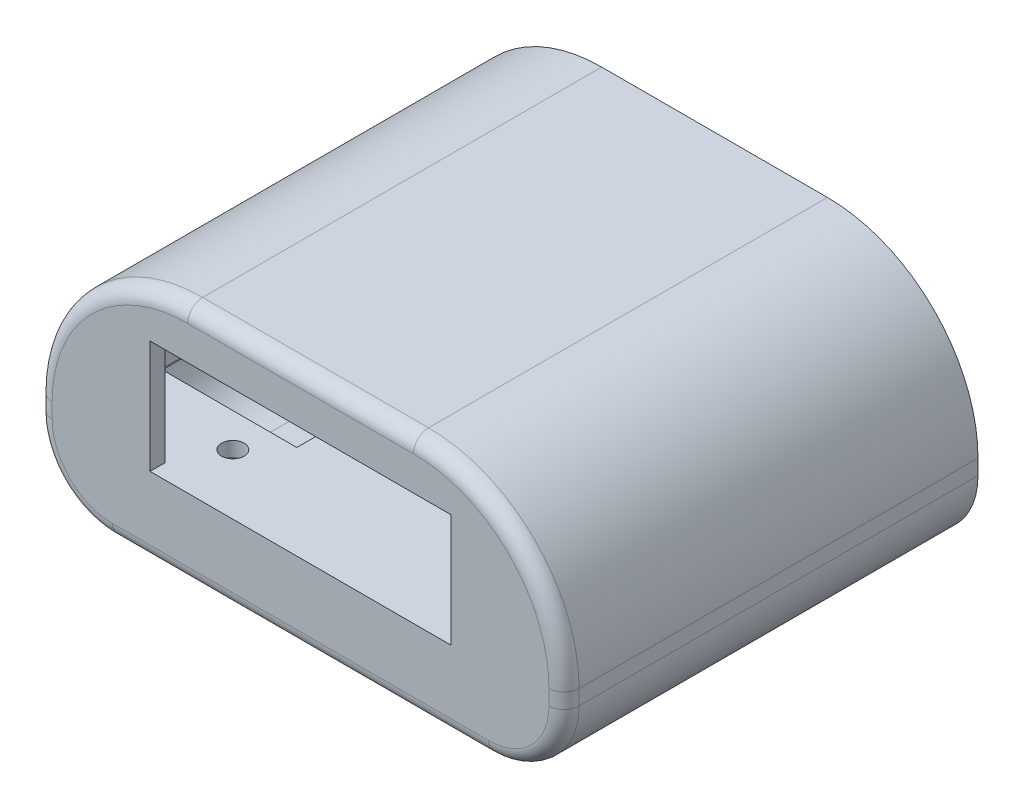
from build123d import *

# Parameters (mm, degrees)
BOSS_EXTRUDE1_DEPTH       = 55
SHELL1_T                  = -2
BOSS_EXTRUDE2_DEPTH       = 10
M3X0_5_TAPPED_HOLE1_D     = 2.5
M3X0_5_TAPPED_HOLE1_DEPTH = 7.5
M3X0_5_TAPPED_HOLE1_TIP   = 0.751075774
BOSS_EXTRUDE3_REACH       = 69.127
SKETCH5_W                 = 66
SKETCH5_H                 = 2
SKETCH6_W                 = 40
SKETCH6_H                 = 15
CUT_EXTRUDE1_DEPTH        = 10
F_3_0MM_DOWEL_HOLE1_D     = 3
F_3_0MM_DOWEL_HOLE1_DEPTH = 4
F_3_0MM_DOWEL_HOLE1_TIP   = 0.901290929
SKETCH9_W                 = 20
SKETCH9_H                 = 16
CUT_EXTRUDE2_DEPTH        = 2
FILLET1_R                 = 2


with BuildPart() as part:
    # Sketch1 → Boss-Extrude1 (new body)
    with BuildSketch(Plane.XY):
        with BuildLine():
            Line((-15, 16), (15, 16))
            ThreePointArc((15, 16), (29.142135624, 10.142135624), (35, -4))
            Line((35, -4), (35, -6))
            ThreePointArc((35, -6), (32.071067812, -13.071067812), (25, -16))
            Line((25, -16), (-25, -16))
            ThreePointArc((-25, -16), (-32.071067812, -13.071067812), (-35, -6))
            Line((-35, -6), (-35, -4))
            ThreePointArc((-35, -4), (-29.142135624, 10.142135624), (-15, 16))
        make_face()
    extrude(amount=BOSS_EXTRUDE1_DEPTH)

    # Shell1
    shell1_openings = [part.faces().sort_by_distance(p)[0] for p in [
        (0, -0.685833175, 0),
    ]]
    offset(amount=SHELL1_T, openings=shell1_openings, kind=Kind.INTERSECTION)

    # Sketch2 → Boss-Extrude2 (add)
    with BuildSketch(Plane(origin=(0, 0, 0), x_dir=(-1, 0, 0), z_dir=(0, 0, -1))):
        with BuildLine():
            Line((-15, 4.48), (-30.87732975, 4.48))
            ThreePointArc((-30.87732975, 4.48), (-24.256349172, 11.437616396), (-15, 14))
            Line((-15, 14), (-15, 4.48))
        make_face()
        with BuildLine():
            Line((15, 4.48), (15, 14))
            ThreePointArc((15, 14), (24.256349172, 11.437616396), (30.87732975, 4.48))
            Line((30.87732975, 4.48), (15, 4.48))
        make_face()
    extrude(amount=-BOSS_EXTRUDE2_DEPTH)

    # M3x0.5 Tapped Hole1
    with Locations(Plane(origin=(0, 0, 0), x_dir=(-1, 0, 0), z_dir=(0, 0, -1))):
        with Locations((-18.4, 8), (21.6, 8)):
            Hole(M3X0_5_TAPPED_HOLE1_D / 2, depth=M3X0_5_TAPPED_HOLE1_DEPTH)
            with Locations((0, 0, -(M3X0_5_TAPPED_HOLE1_DEPTH + M3X0_5_TAPPED_HOLE1_TIP / 2))):  # 118° drill point
                Cone(0, M3X0_5_TAPPED_HOLE1_D / 2, M3X0_5_TAPPED_HOLE1_TIP, mode=Mode.SUBTRACT)

    # Sketch5 → Boss-Extrude3 (add, up to next)
    with BuildSketch(Plane(origin=(0, 0, 0), x_dir=(-1, 0, 0), z_dir=(0, 0, -1)), mode=Mode.PRIVATE) as boss_extrude3_sk1:
        with Locations((0, -6.52)):
            Rectangle(SKETCH5_W, SKETCH5_H)
    boss_extrude3_tool1 = extrude(boss_extrude3_sk1.sketch, amount=-BOSS_EXTRUDE3_REACH, mode=Mode.PRIVATE) - part.part
    add(boss_extrude3_tool1.solids().sort_by_distance((0, -6.52, 0))[0])

    # Sketch6 → Cut-Extrude1 (cut)
    with BuildSketch(Plane(origin=(0, 0, 53), x_dir=(-1, 0, 0), z_dir=(0, 0, -1))):
        with Locations((0, 1.98)):
            Rectangle(SKETCH6_W, SKETCH6_H)
    extrude(amount=-CUT_EXTRUDE1_DEPTH, mode=Mode.SUBTRACT)

    # Ø3.0mm Dowel Hole1
    with Locations(Plane(origin=(0, -5.52, 0), x_dir=(1, 0, 0), z_dir=(0, 1, 0))):
        with Locations((-17, -47), (-17, -22), (17, -34.5)):
            Hole(F_3_0MM_DOWEL_HOLE1_D / 2, depth=F_3_0MM_DOWEL_HOLE1_DEPTH)
            with Locations((0, 0, -(F_3_0MM_DOWEL_HOLE1_DEPTH + F_3_0MM_DOWEL_HOLE1_TIP / 2))):  # 118° drill point
                Cone(0, F_3_0MM_DOWEL_HOLE1_D / 2, F_3_0MM_DOWEL_HOLE1_TIP, mode=Mode.SUBTRACT)

    # Sketch9 → Cut-Extrude2 (cut)
    with BuildSketch(Plane(origin=(0, -5.52, 0), x_dir=(1, 0, 0), z_dir=(0, 1, 0))):
        with Locations((-23, -34.5)):
            Rectangle(SKETCH9_W, SKETCH9_H)
    extrude(amount=-CUT_EXTRUDE2_DEPTH, mode=Mode.SUBTRACT)

    # Fillet1
    fillet1_edges = [part.edges().sort_by_distance(p)[0] for p in [
        (29.142135624, 10.142135624, 55),
        (0, 16, 55),
        (-29.142135624, 10.142135624, 55),
        (-35, -5, 55),
        (-32.071067812, -13.071067812, 55),
        (0, -16, 55),
        (32.071067812, -13.071067812, 55),
        (35, -5, 55),
    ]]
    fillet(fillet1_edges, radius=FILLET1_R)


solid = part.part
